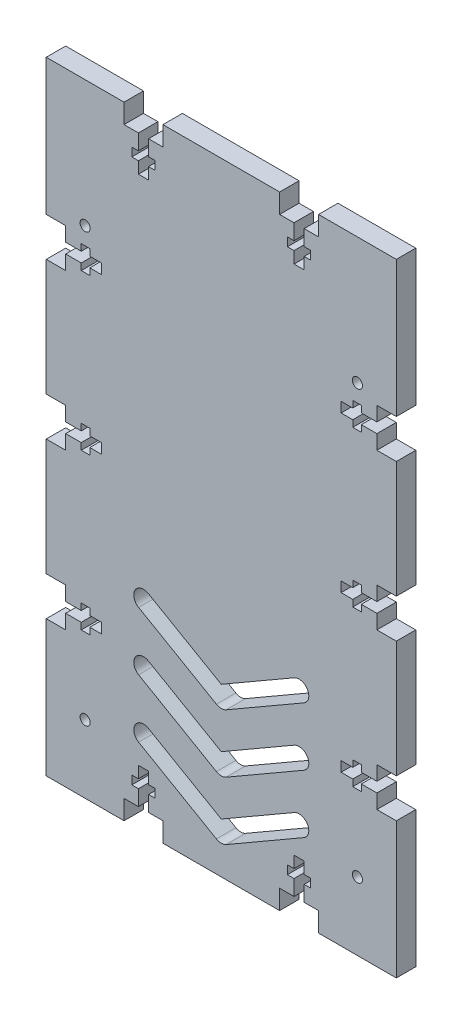
from build123d import *

# Parameters (mm, degrees)
SKETCH1_W            = 114.3
SKETCH1_H            = 203.2
BOSS_EXTRUDE1_DEPTH  = 6.35
CUT_EXTRUDE2_DEPTH   = 117.743329574
CUT_EXTRUDE3_DEPTH   = 117.743329574
CUT_EXTRUDE4_DEPTH   = 117.743329574
MIRROR3_COPY_1_DEPTH = 117.743329574
MIRROR3_COPY_2_DEPTH = 117.743329574
SKETCH7_R            = 1.651
CUT_EXTRUDE7_DEPTH   = 117.743329574
CUT_EXTRUDE8_DEPTH   = 117.743329574
LPATTERN1_COUNT      = 3
LPATTERN1_PITCH      = 19.05


with BuildPart() as part:
    # Sketch1 → Boss-Extrude1 (new body)
    with BuildSketch(Plane.XY):
        Rectangle(SKETCH1_W, SKETCH1_H)
    extrude(amount=BOSS_EXTRUDE1_DEPTH)

    # Sketch2 → Cut-Extrude2 (cut, through all)
    with BuildSketch(Plane.XY.offset(6.35)):
        Polygon((-57.15, 6.35), (-57.15, -6.35), (-50.8, -6.35), (-50.8, -1.651), (-45.72, -1.651), (-45.72, -3.81), (-42.926, -3.81), (-42.926, -1.651), (-39.116, -1.651), (-39.116, 1.651), (-42.926, 1.651), (-42.926, 3.81), (-45.72, 3.81), (-45.72, 1.651), (-50.8, 1.651), (-50.8, 6.35), align=None)
    cut_extrude2 = extrude(amount=-CUT_EXTRUDE2_DEPTH, mode=Mode.SUBTRACT)

    # Sketch3 → Cut-Extrude3 (cut, through all)
    with BuildSketch(Plane.XY.offset(6.35)):
        Polygon((-31.75, 101.6), (-31.75, 95.25), (-27.051, 95.25), (-27.051, 90.17), (-29.21, 90.17), (-29.21, 87.376), (-27.051, 87.376), (-27.051, 83.566), (-23.749, 83.566), (-23.749, 87.376), (-21.59, 87.376), (-21.59, 90.17), (-23.749, 90.17), (-23.749, 95.25), (-19.05, 95.25), (-19.05, 101.6), align=None)
    cut_extrude3 = extrude(amount=-CUT_EXTRUDE3_DEPTH, mode=Mode.SUBTRACT)

    # Sketch4 → Cut-Extrude4 (cut, through all)
    with BuildSketch(Plane.XY.offset(6.35)):
        Polygon((-57.15, 57.15), (-50.8, 57.15), (-50.8, 52.451), (-45.72, 52.451), (-45.72, 54.61), (-42.926, 54.61), (-42.926, 52.451), (-39.116, 52.451), (-39.116, 49.149), (-42.926, 49.149), (-42.926, 46.99), (-45.72, 46.99), (-45.72, 49.149), (-50.8, 49.149), (-50.8, 44.45), (-57.15, 44.45), align=None)
    cut_extrude4 = extrude(amount=-CUT_EXTRUDE4_DEPTH, mode=Mode.SUBTRACT)

    # Mirror1: Cut-Extrude3, Cut-Extrude4 across plane
    add(cut_extrude3.mirror(Plane.ZX), mode=Mode.SUBTRACT)
    add(cut_extrude4.mirror(Plane.ZX), mode=Mode.SUBTRACT)

    # Mirror3: Cut-Extrude2, Cut-Extrude3, Cut-Extrude4 across plane
    add(cut_extrude2.mirror(Plane(origin=(0, 0, 0), x_dir=(0, 0, 1), z_dir=(1, 0, 0))), mode=Mode.SUBTRACT)
    add(cut_extrude3.mirror(Plane(origin=(0, 0, 0), x_dir=(0, 0, 1), z_dir=(1, 0, 0))), mode=Mode.SUBTRACT)
    add(cut_extrude4.mirror(Plane(origin=(0, 0, 0), x_dir=(0, 0, 1), z_dir=(1, 0, 0))), mode=Mode.SUBTRACT)

    # Mirror3 copy 1 sketch → Mirror3 copy 1 (cut, through all)
    with BuildSketch(Plane(origin=(0, 0, 6.35), x_dir=(-1, 0, 0), z_dir=(0, 0, 1))):
        Polygon((-31.75, 101.6), (-31.75, 95.25), (-27.051, 95.25), (-27.051, 90.17), (-29.21, 90.17), (-29.21, 87.376), (-27.051, 87.376), (-27.051, 83.566), (-23.749, 83.566), (-23.749, 87.376), (-21.59, 87.376), (-21.59, 90.17), (-23.749, 90.17), (-23.749, 95.25), (-19.05, 95.25), (-19.05, 101.6), align=None)
    extrude(amount=-MIRROR3_COPY_1_DEPTH, mode=Mode.SUBTRACT)

    # Mirror3 copy 2 sketch → Mirror3 copy 2 (cut, through all)
    with BuildSketch(Plane(origin=(0, 0, 6.35), x_dir=(-1, 0, 0), z_dir=(0, 0, 1))):
        Polygon((-57.15, 57.15), (-50.8, 57.15), (-50.8, 52.451), (-45.72, 52.451), (-45.72, 54.61), (-42.926, 54.61), (-42.926, 52.451), (-39.116, 52.451), (-39.116, 49.149), (-42.926, 49.149), (-42.926, 46.99), (-45.72, 46.99), (-45.72, 49.149), (-50.8, 49.149), (-50.8, 44.45), (-57.15, 44.45), align=None)
    extrude(amount=-MIRROR3_COPY_2_DEPTH, mode=Mode.SUBTRACT)

    # Sketch7 → Cut-Extrude7 (cut, through all)
    with BuildSketch(Plane(origin=(0, 0, 0), x_dir=(-1, 0, 0), z_dir=(0, 0, -1))):
        with Locations((-44.45, 60.325)):
            Circle(SKETCH7_R)
        with Locations((44.45, 60.325)):
            Circle(SKETCH7_R)
        with Locations((44.45, -79.375)):
            Circle(SKETCH7_R)
        with Locations((-44.45, -79.375)):
            Circle(SKETCH7_R)
    extrude(amount=-CUT_EXTRUDE7_DEPTH, mode=Mode.SUBTRACT)

    # Sketch8 → Cut-Extrude8 (cut, through all)
    with BuildSketch(Plane.XY.offset(6.35)):
        with BuildLine():
            Line((26.9875, -76.98493382), (1.5875, -91.649630657))
            ThreePointArc((1.5875, -91.649630657), (0, -92.075), (-1.5875, -91.649630657))
            Line((-1.5875, -91.649630657), (-26.9875, -76.98493382))
            ThreePointArc((-26.9875, -76.98493382), (-28.149630657, -72.647803163), (-23.8125, -71.485672506))
            Line((-23.8125, -71.485672506), (0, -85.233825791))
            Line((0, -85.233825791), (23.8125, -71.485672506))
            ThreePointArc((23.8125, -71.485672506), (28.149630657, -72.647803163), (26.9875, -76.98493382))
        make_face()
    cut_extrude8 = extrude(amount=-CUT_EXTRUDE8_DEPTH, mode=Mode.SUBTRACT)

    # LPattern1: Cut-Extrude8 ×3
    with Locations(*[(0, i * LPATTERN1_PITCH, 0) for i in range(1, LPATTERN1_COUNT)]):
        add(cut_extrude8, mode=Mode.SUBTRACT)


solid = part.part
